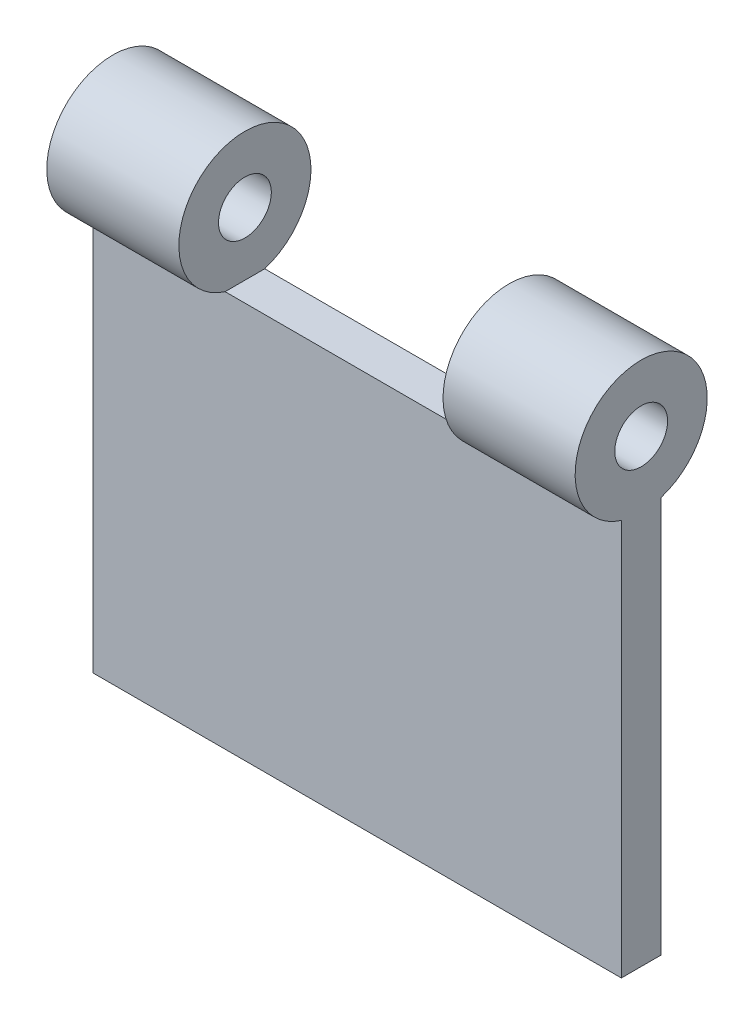
from build123d import *

# Parameters (mm, degrees)
SKETCH2_R           = 2
BOSS_EXTRUDE1_DEPTH = 20
SKETCH3_R           = 2
CUT_EXTRUDE1_DEPTH  = 10


with BuildPart() as part:
    # Sketch2 → Boss-Extrude1 (new, symmetric)
    with BuildSketch(Plane(origin=(0, 0, 0), x_dir=(0, 0, -1), z_dir=(1, 0, 0))):
        with BuildLine():
            Line((-1.5, 21.918644487), (-1.5, -8.081355513))
            Line((-1.5, -8.081355513), (1.5, -8.081355513))
            Line((1.5, -8.081355513), (1.5, 21.918644487))
            ThreePointArc((1.5, 21.918644487), (0, 31.688340494), (-1.5, 21.918644487))
        make_face()
        with Locations((0, 26.688340494)):
            Circle(SKETCH2_R, mode=Mode.SUBTRACT)
    extrude(amount=BOSS_EXTRUDE1_DEPTH, both=True)

    # Sketch3 → Cut-Extrude1 (cut, symmetric)
    with BuildSketch(Plane(origin=(0, 0, 0), x_dir=(0, 0, -1), z_dir=(1, 0, 0))):
        with BuildLine():
            Line((1.5, 21.918644487), (-1.5, 21.918644487))
            ThreePointArc((-1.5, 21.918644487), (0, 31.688340494), (1.5, 21.918644487))
        make_face()
        with Locations((0, 26.688340494)):
            Circle(SKETCH3_R, mode=Mode.SUBTRACT)
    extrude(amount=CUT_EXTRUDE1_DEPTH, both=True, mode=Mode.SUBTRACT)


solid = part.part
